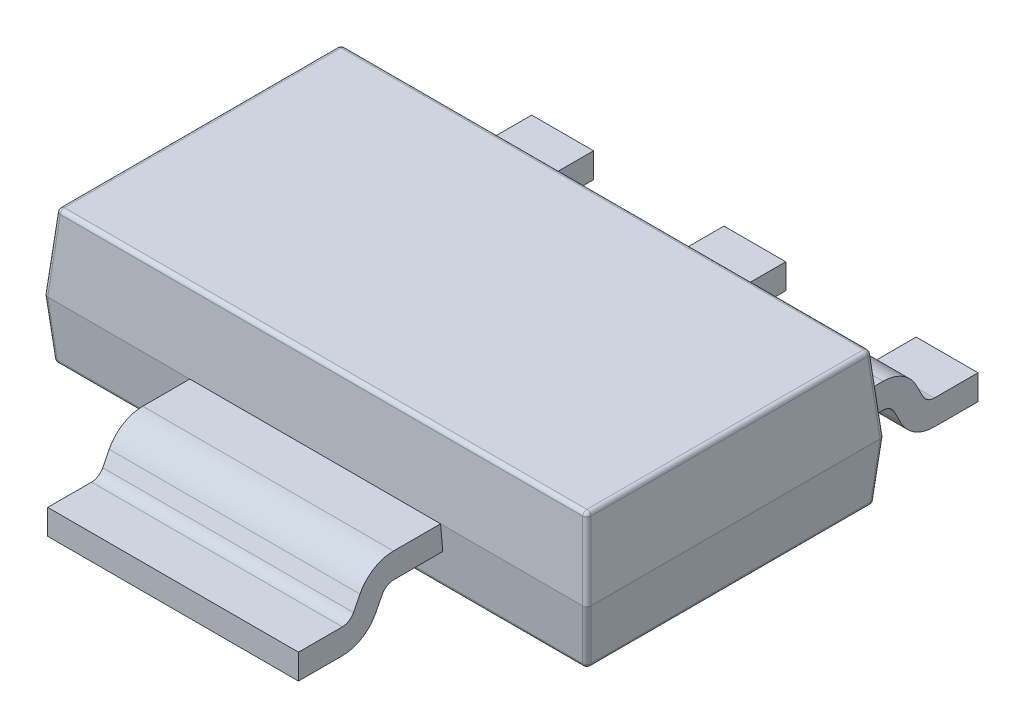
from build123d import *

# Parameters (mm, degrees)
SKETCH1_W                = 6.5
SKETCH1_H                = 3.56
EXTRUDE1_DEPTH           = 0.9
EXTRUDE1_TAPER           = 5
EXTRUDE1_OTHER_WAY_DEPTH = 0.7
EXTRUDE1_OTHER_WAY_TAPER = 5
EXTRUDE2_DEPTH           = 0.37
LPATTERN1_COUNT          = 2
LPATTERN1_PITCH          = 2.3
LPATTERN1_COL_COUNT      = 2
LPATTERN1_COL_PITCH      = 2.3
EXTRUDE3_DEPTH           = 1.5
EXTRUDE3_DEPTH_BACK      = 1.5
FILLET2_R                = 0.45
FILLET1_R                = 0.15
FILLET3_R                = 0.05


with BuildPart() as part:
    # Sketch1 → Extrude1 (new body)
    with BuildSketch(Plane(origin=(0, 0, 0), x_dir=(1, 0, 0), z_dir=(0, 1, 0))):
        Rectangle(SKETCH1_W, SKETCH1_H)
    extrude(amount=EXTRUDE1_DEPTH, taper=EXTRUDE1_TAPER)

    # Sketch1 → Extrude1 other way (add)
    with BuildSketch(Plane(origin=(0, 0, 0), x_dir=(1, 0, 0), z_dir=(0, 1, 0))):
        Rectangle(SKETCH1_W, SKETCH1_H)
    extrude(amount=-EXTRUDE1_OTHER_WAY_DEPTH, taper=EXTRUDE1_OTHER_WAY_TAPER)

    # Sketch2 → Extrude2 (add, symmetric)
    with BuildSketch(Plane(origin=(0, 0, 0), x_dir=(0, 0, -1), z_dir=(1, 0, 0))):
        Polygon((1.78, -0.3), (1.580889401, -0.3), (1.78, 0), (2.619268021, 0), (2.863840236, -0.48), (3.48, -0.48), (3.48, -0.78), (2.68, -0.78), (2.435427784, -0.3), align=None)
    extrude2 = extrude(amount=EXTRUDE2_DEPTH, both=True)

    # LPattern1: Extrude2 ×2
    with Locations(*[(-i * LPATTERN1_PITCH, 0, 0) for i in range(1, LPATTERN1_COUNT)]):
        add(extrude2)

    # LPattern1 col: Extrude2 ×2
    with Locations(*[(i * LPATTERN1_COL_PITCH, 0, 0) for i in range(1, LPATTERN1_COL_COUNT)]):
        add(extrude2)

    # Sketch2<3> → Extrude3 (add, two sides: drawn at the far end of the back side and taken through both)
    with BuildSketch(Plane(origin=(0, 0, 0), x_dir=(0, 0, -1), z_dir=(1, 0, 0)).offset(-EXTRUDE3_DEPTH_BACK)):
        Polygon((-2.68, -0.78), (-3.48, -0.78), (-3.48, -0.48), (-2.863840236, -0.48), (-2.619268021, 0), (-1.78, 0), (-1.580889401, -0.3), (-1.78, -0.3), (-2.435427784, -0.3), align=None)
    extrude(amount=EXTRUDE3_DEPTH + EXTRUDE3_DEPTH_BACK)

    # Fillet2
    fillet2_edges = [part.edges().sort_by_distance(p)[0] for p in [
        (0, -0.78, 2.68),
        (0, 0, 2.619268021),
        (0, -0.78, -2.68),
        (0, 0, -2.619268021),
        (2.3, -0.78, -2.68),
        (2.3, 0, -2.619268021),
        (-2.3, -0.78, -2.68),
        (-2.3, 0, -2.619268021),
    ]]
    fillet(fillet2_edges, radius=FILLET2_R)

    # Fillet1
    fillet1_edges = [part.edges().sort_by_distance(p)[0] for p in [
        (0, -0.3, 2.435427784),
        (0, -0.48, 2.863840236),
        (0, -0.3, -2.435427784),
        (0, -0.48, -2.863840236),
        (2.3, -0.3, -2.435427784),
        (2.3, -0.48, -2.863840236),
        (-2.3, -0.3, -2.435427784),
        (-2.3, -0.48, -2.863840236),
    ]]
    fillet(fillet1_edges, radius=FILLET1_R)

    # Fillet3
    fillet3_edges = [part.edges().sort_by_distance(p)[0] for p in [
        (3.171260203, 0.9, 0),
        (-3.188757936, -0.7, 0),
        (-3.219378968, -0.35, 1.749378968),
        (0, -0.7, -1.718757936),
        (0, 0.9, -1.701260203),
        (-3.219378968, -0.35, -1.749378968),
        (3.188757936, -0.7, 0),
        (3.219378968, -0.35, -1.749378968),
        (0, -0.7, 1.718757936),
        (3.219378968, -0.35, 1.749378968),
        (-3.171260203, 0.9, 0),
        (0, 0.9, 1.701260203),
        (-3.210630101, 0.45, -1.740630101),
        (3.210630101, 0.45, -1.740630101),
        (3.210630101, 0.45, 1.740630101),
        (-3.210630101, 0.45, 1.740630101),
    ]]
    fillet(fillet3_edges, radius=FILLET3_R)


solid = part.part
